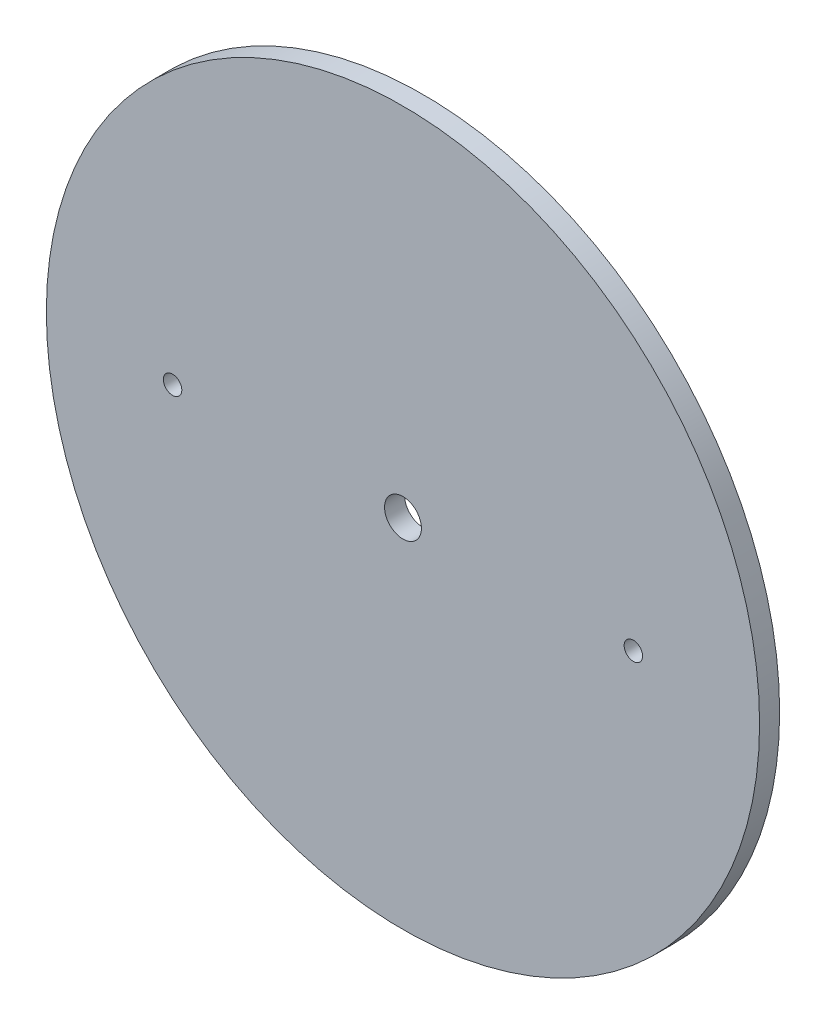
from build123d import *

# Parameters (mm, degrees)
SKETCH1_R           = 71.1
SKETCH1_R_2         = 1.837270341
SKETCH1_R_3         = 3.674540682
BOSS_EXTRUDE1_DEPTH = 4


with BuildPart() as part:
    # Sketch1 → Boss-Extrude1 (new body)
    with BuildSketch(Plane(origin=(0, 0, -5), x_dir=(-1, 0, 0), z_dir=(0, 0, -1))):
        with Locations(Location((0, 0, 0), (0, 0, 180))):
            Circle(SKETCH1_R)
        with Locations(Location((45.93175853, 0, 0), (0, 0, 180))):
            Circle(SKETCH1_R_2, mode=Mode.SUBTRACT)
        with Locations(Location((-45.93175853, 0, 0), (0, 0, 180))):
            Circle(SKETCH1_R_2, mode=Mode.SUBTRACT)
        with Locations(Location((0, 0, 0), (0, 0, 180))):
            Circle(SKETCH1_R_3, mode=Mode.SUBTRACT)
    extrude(amount=-BOSS_EXTRUDE1_DEPTH)


solid = part.part
